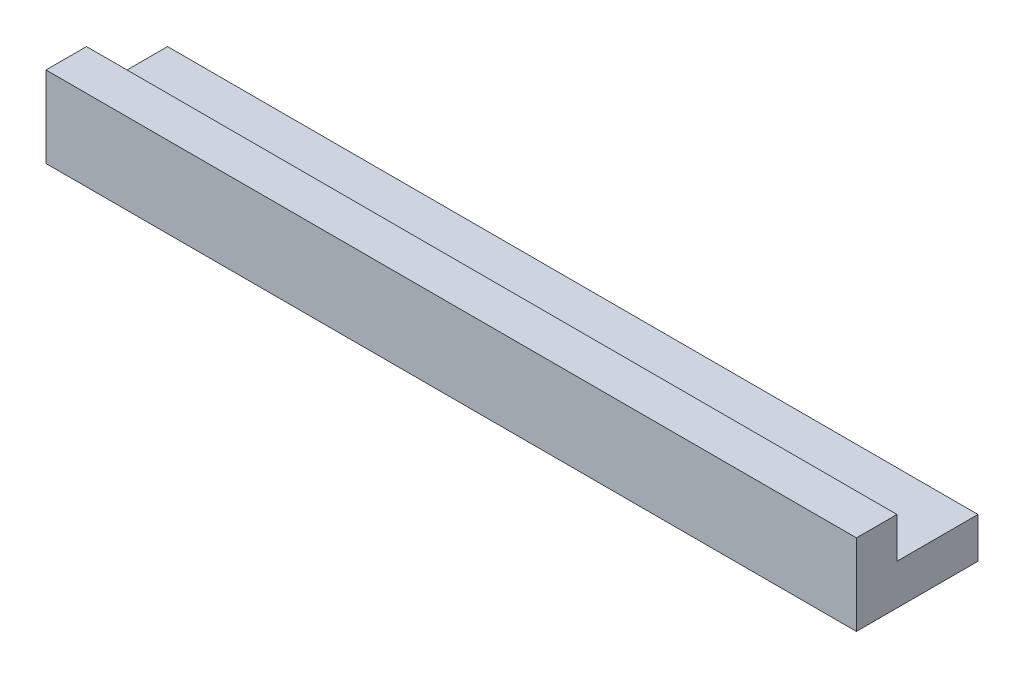
from build123d import *

# Parameters (mm, degrees)
BOSS_EXTRUDE1_DEPTH = 40


with BuildPart() as part:
    # Sketch2 → Boss-Extrude1 (new body)
    with BuildSketch(Plane(origin=(0, 0, 0), x_dir=(0, 0, -1), z_dir=(1, 0, 0))):
        Polygon((0, 0), (0, -2), (4, -2), (4, -4), (-2, -4), (-2, 0), align=None)
    extrude(amount=BOSS_EXTRUDE1_DEPTH)


solid = part.part
